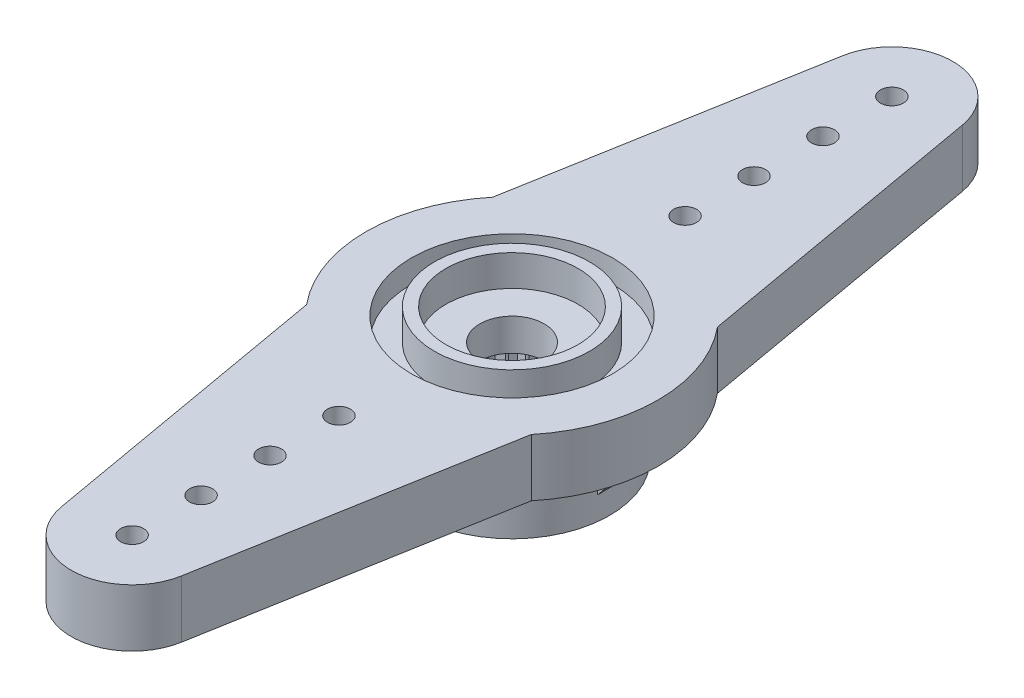
from build123d import *

# Parameters (mm, degrees)
BASES_R                     = 6.35
BASE_DEPTH                  = 5.4
TOPBORES_R                  = 1.4
TOP_BORE_DEPTH              = 11.478788098
HORN_START                  = -2.5
HORN_HALF_DEPTH             = 2.5
HORNATTACHS_R               = 0.5
HORN_ATTACH_DEPTH           = 21.913031822
HA_LP_COUNT                 = 4
HA_LP_PITCH                 = 3
HORN_BODIES_COPY_1_SKETCH_R = 0.5
HORN_BODIES_COPY_1_DEPTH    = 21.913031822
HORN_BODIES_COPY_2_SKETCH_R = 0.5
HORN_BODIES_COPY_2_DEPTH    = 21.913031822
HORN_BODIES_COPY_3_SKETCH_R = 0.5
HORN_BODIES_COPY_3_DEPTH    = 21.913031822
TOOTH_DEPTH                 = 3
TOOTH_CP_COUNT              = 26
BOTTOMBORES_R               = 2.6
BOTTOM_BORE_DEPTH           = 3
HOLDINGSHAFTS_R             = 6.35
HOLDINGSHAFTS_R_2           = 4.25
HOLDING_SHAFT_DEPTH         = 2.9
RIB_DEPTH                   = 0.5
RIB_CP_COUNT                = 4
TOPCUTS_R                   = 4.375
TOP_CUT_DEPTH               = 1
TOPPOCKETCYLINDERS_R        = 3.375
TOPPOCKETCYLINDERS_R_2      = 2.875
TOP_POCKET_CYLINDER_DEPTH   = 1.35


with BuildPart() as part:
    # BaseS → BASE (new body)
    with BuildSketch(Plane(origin=(0, 0, 0), x_dir=(1, 0, 0), z_dir=(0, 1, 0))):
        with Locations(Location((0, 0, 0), (0, 0, 90))):
            Circle(BASES_R)
    extrude(amount=BASE_DEPTH)

    # TopBoreS → TOP BORE (cut, through all)
    with BuildSketch(Plane(origin=(0, 5.4, 0), x_dir=(1, 0, 0), z_dir=(0, 1, 0))):
        with Locations(Location((0, 0, 0), (0, 0, 270))):
            Circle(TOPBORES_R)
    extrude(amount=-TOP_BORE_DEPTH, mode=Mode.SUBTRACT)

    # HornHalfS → HORN HALF (add)
    with BuildSketch(Plane(origin=(0, 5.4, 0), x_dir=(1, 0, 0), z_dir=(0, 1, 0)).offset(HORN_START)):
        with BuildLine():
            Line((-2.609740545, 16.990167671), (-4.891612682, 4.049027706))
            ThreePointArc((-4.891612682, 4.049027706), (0, 6.35), (4.891612682, 4.049027706))
            Line((4.891612682, 4.049027706), (2.609740545, 16.990167671))
            ThreePointArc((2.609740545, 16.990167671), (0, 19.18), (-2.609740545, 16.990167671))
        make_face()
    horn_half = extrude(amount=HORN_HALF_DEPTH)

    # HornAttachS → HORN ATTACH (cut, through all)
    with BuildSketch(Plane(origin=(0, 5.4, 0), x_dir=(1, 0, 0), z_dir=(0, 1, 0))):
        with Locations(Location((0, 16.53, 0), (0, 0, 270))):
            Circle(HORNATTACHS_R)
    horn_attach = extrude(amount=-HORN_ATTACH_DEPTH, mode=Mode.SUBTRACT)

    # HA LP: HORN ATTACH ×4
    with Locations(*[(0, 0, i * HA_LP_PITCH) for i in range(1, HA_LP_COUNT)]):
        add(horn_attach, mode=Mode.SUBTRACT)

    # HORN BODIES: HORN HALF, HORN ATTACH across plane
    add(horn_half.mirror(Plane.XY))
    add(horn_attach.mirror(Plane.XY), mode=Mode.SUBTRACT)

    # HORN BODIES copy 1 sketch → HORN BODIES copy 1 (cut, through all)
    with BuildSketch(Plane(origin=(0, 5.4, -3), x_dir=(1, 0, 0), z_dir=(0, 1, 0))):
        with Locations((0, -16.53)):
            Circle(HORN_BODIES_COPY_1_SKETCH_R)
    extrude(amount=-HORN_BODIES_COPY_1_DEPTH, mode=Mode.SUBTRACT)

    # HORN BODIES copy 2 sketch → HORN BODIES copy 2 (cut, through all)
    with BuildSketch(Plane(origin=(0, 5.4, -6), x_dir=(1, 0, 0), z_dir=(0, 1, 0))):
        with Locations((0, -16.53)):
            Circle(HORN_BODIES_COPY_2_SKETCH_R)
    extrude(amount=-HORN_BODIES_COPY_2_DEPTH, mode=Mode.SUBTRACT)

    # HORN BODIES copy 3 sketch → HORN BODIES copy 3 (cut, through all)
    with BuildSketch(Plane(origin=(0, 5.4, -9), x_dir=(1, 0, 0), z_dir=(0, 1, 0))):
        with Locations((0, -16.53)):
            Circle(HORN_BODIES_COPY_3_SKETCH_R)
    extrude(amount=-HORN_BODIES_COPY_3_DEPTH, mode=Mode.SUBTRACT)

    # ToothS → TOOTH (cut)
    with BuildSketch(Plane.XZ):
        with BuildLine():
            Line((0, -2.9), (0.262912611, -2.586672952))
            ThreePointArc((0.262912611, -2.586672952), (0, -2.6), (-0.262912611, -2.586672952))
            Line((-0.262912611, -2.586672952), (0, -2.9))
        make_face()
    tooth = extrude(amount=-TOOTH_DEPTH, mode=Mode.SUBTRACT)

    # TOOTH CP: TOOTH ×26 about axis
    tooth_cp_axis = Axis((0, 0, 0), (0, 1, 0))
    for i in range(1, TOOTH_CP_COUNT):
        add(tooth.rotate(tooth_cp_axis, i * 360 / TOOTH_CP_COUNT), mode=Mode.SUBTRACT)

    # BottomBoreS → BOTTOM BORE (cut)
    with BuildSketch(Plane(origin=(0, 0, 0), x_dir=(-1, 0, 0), z_dir=(0, -1, 0))):
        Circle(BOTTOMBORES_R)
    extrude(amount=-BOTTOM_BORE_DEPTH, mode=Mode.SUBTRACT)

    # HoldingShaftS → HOLDING SHAFT (cut)
    with BuildSketch(Plane.XZ):
        Circle(HOLDINGSHAFTS_R)
        with Locations(Location((0, 0, 0), (0, 0, 270))):
            Circle(HOLDINGSHAFTS_R_2, mode=Mode.SUBTRACT)
    extrude(amount=-HOLDING_SHAFT_DEPTH, mode=Mode.SUBTRACT)

    # RibS → RIB (add, symmetric)
    with BuildSketch(Plane.XY):
        Polygon((4.21, 1), (5.804289299, 2.9), (4.21, 2.9), (4.16, 2.9), (4.16, 1), align=None)
    rib = extrude(amount=RIB_DEPTH, both=True)

    # RIB CP: RIB ×4 about axis
    rib_cp_axis = Axis((0, 0, 0), (0, 1, 0))
    for i in range(1, RIB_CP_COUNT):
        add(rib.rotate(rib_cp_axis, i * 360 / RIB_CP_COUNT))

    # TopCutS → TOP CUT (cut)
    with BuildSketch(Plane(origin=(0, 5.4, 0), x_dir=(1, 0, 0), z_dir=(0, 1, 0))):
        with Locations(Location((0, 0, 0), (0, 0, 270))):
            Circle(TOPCUTS_R)
    extrude(amount=-TOP_CUT_DEPTH, mode=Mode.SUBTRACT)

    # TopPocketCylinderS → TOP POCKET CYLINDER (add)
    with BuildSketch(Plane(origin=(0, 4.4, 0), x_dir=(1, 0, 0), z_dir=(0, 1, 0))):
        with Locations(Location((0, 0, 0), (0, 0, 270))):
            Circle(TOPPOCKETCYLINDERS_R)
        with Locations(Location((0, 0, 0), (0, 0, 270))):
            Circle(TOPPOCKETCYLINDERS_R_2, mode=Mode.SUBTRACT)
    extrude(amount=TOP_POCKET_CYLINDER_DEPTH)


solid = part.part
